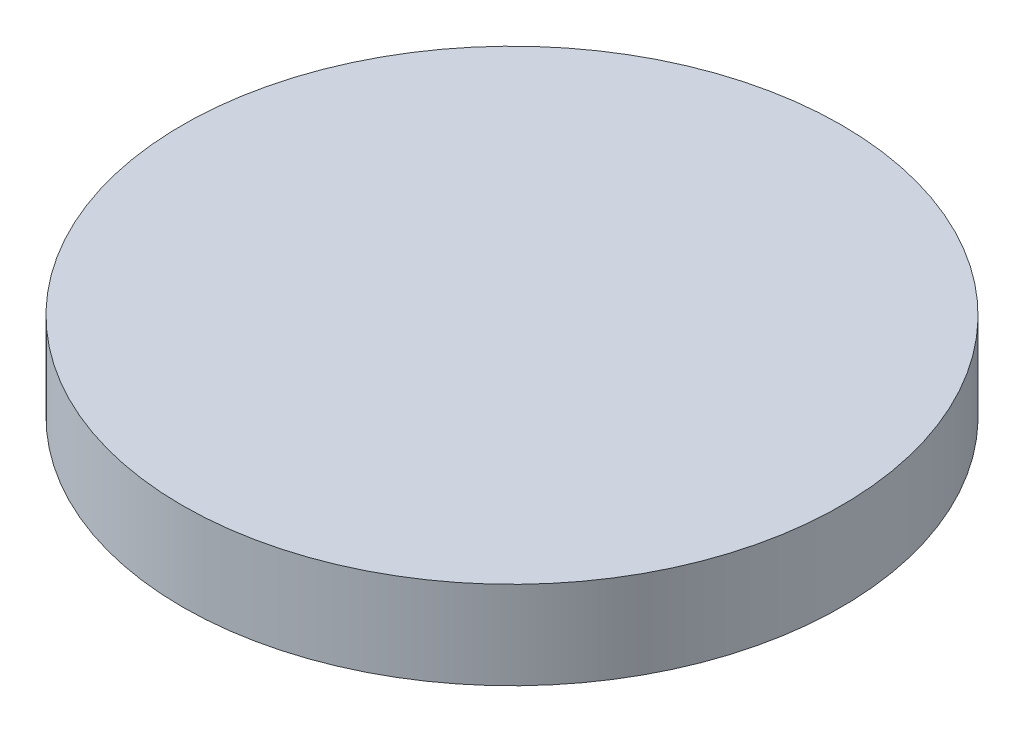
from build123d import *

# Parameters (mm, degrees)
SKETCH1_R           = 23.8125
BOSS_EXTRUDE1_DEPTH = 6.35


with BuildPart() as part:
    # Sketch1 → Boss-Extrude1 (new body)
    with BuildSketch(Plane(origin=(0, 0, 0), x_dir=(1, 0, 0), z_dir=(0, 1, 0))):
        with Locations(Location((-59.303376565, 6.578354685, 0), (0, 0, 270))):
            Circle(SKETCH1_R)
    extrude(amount=BOSS_EXTRUDE1_DEPTH)


solid = part.part
